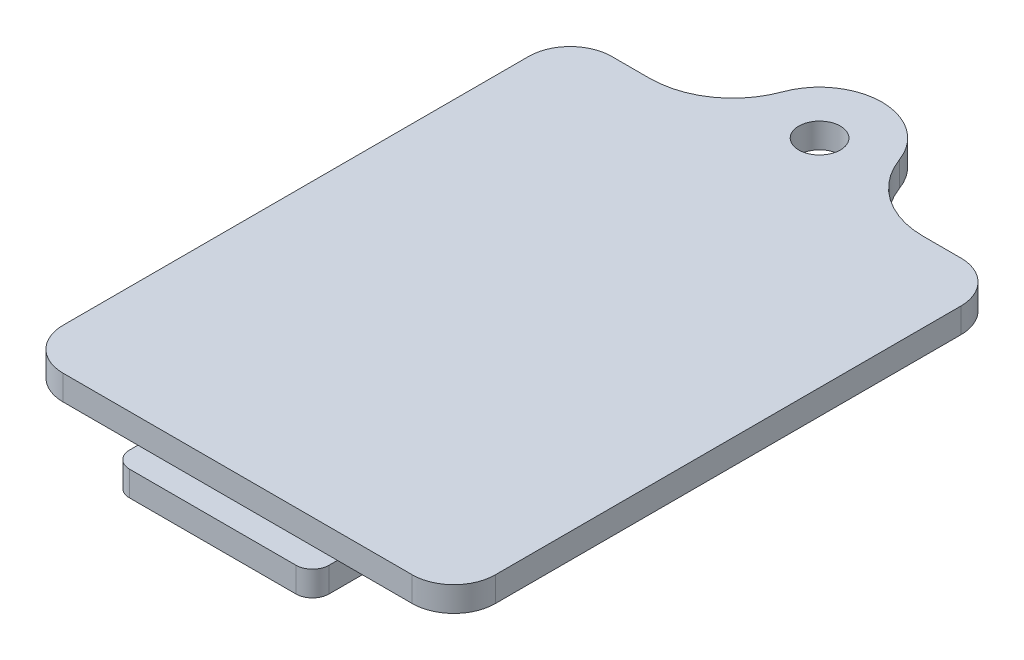
from build123d import *

# Parameters (mm, degrees)
SKETCH1_R           = 2.5
BOSS_EXTRUDE1_DEPTH = 3
BOSS_EXTRUDE2_DEPTH = 3


with BuildPart() as part:
    # Sketch1 → Boss-Extrude1 (new body)
    with BuildSketch(Plane(origin=(0, 0, 0), x_dir=(1, 0, 0), z_dir=(0, 1, 0))):
        with BuildLine():
            Line((-21, 66), (-16.439282223, 66))
            ThreePointArc((-16.439282223, 66), (-10.707167181, 67.805925486), (-7.045406667, 72.571428571))
            ThreePointArc((-7.045406667, 72.571428571), (0, 77.5), (7.045406667, 72.571428571))
            ThreePointArc((7.045406667, 72.571428571), (10.707167181, 67.805925486), (16.439282223, 66))
            Line((16.439282223, 66), (21, 66))
            ThreePointArc((21, 66), (24.535533906, 64.535533906), (26, 61))
            Line((26, 61), (26, 5))
            ThreePointArc((26, 5), (24.535533906, 1.464466094), (21, 0))
            Line((21, 0), (-21, 0))
            ThreePointArc((-21, 0), (-24.535533906, 1.464466094), (-26, 5))
            Line((-26, 5), (-26, 61))
            ThreePointArc((-26, 61), (-24.535533906, 64.535533906), (-21, 66))
        make_face()
        with Locations(Location((0, 70, 0), (0, 0, 270))):
            Circle(SKETCH1_R, mode=Mode.SUBTRACT)
    extrude(amount=BOSS_EXTRUDE1_DEPTH)

    # Sketch2 → Boss-Extrude2 (add)
    with BuildSketch(Plane.XZ):
        with BuildLine():
            Line((-10, -9), (10, -9))
            ThreePointArc((10, -9), (11.414213562, -8.414213562), (12, -7))
            Line((12, -7), (12, 1))
            ThreePointArc((12, 1), (11.414213562, 2.414213562), (10, 3))
            Line((10, 3), (-10, 3))
            ThreePointArc((-10, 3), (-11.414213562, 2.414213562), (-12, 1))
            Line((-12, 1), (-12, -7))
            ThreePointArc((-12, -7), (-11.414213562, -8.414213562), (-10, -9))
        make_face()
    extrude(amount=BOSS_EXTRUDE2_DEPTH)


solid = part.part
